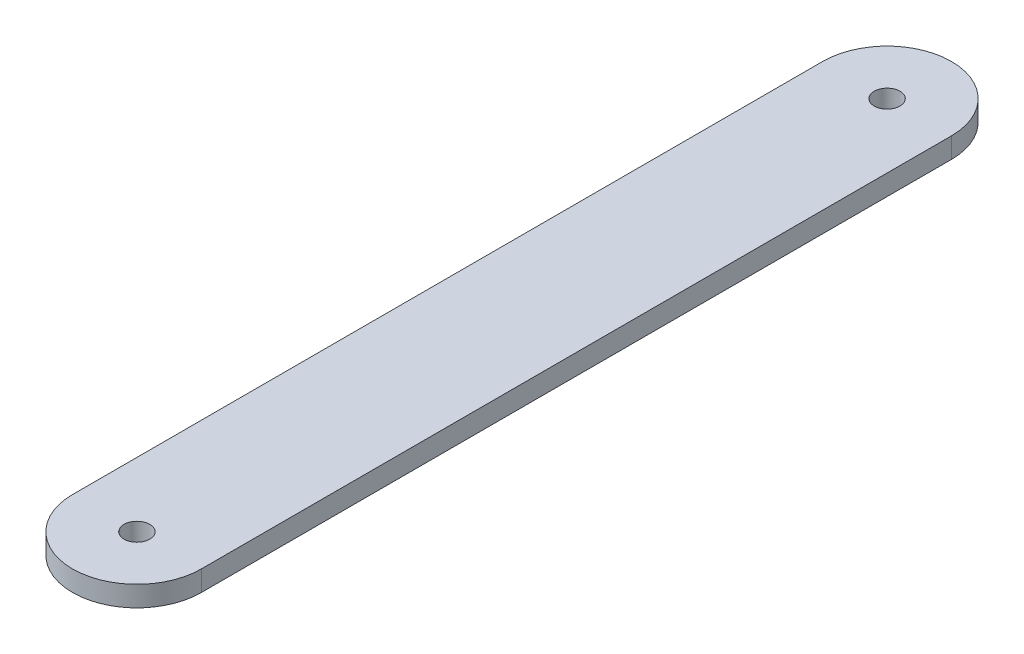
from build123d import *

# Parameters (mm, degrees)
SKETCH2_R           = 1
BOSS_EXTRUDE1_DEPTH = 1.5875


with BuildPart() as part:
    # Sketch2 → Boss-Extrude1 (new body)
    with BuildSketch(Plane(origin=(0, 0, 0), x_dir=(1, 0, 0), z_dir=(0, 1, 0))):
        with BuildLine():
            Line((-5, 58.2405), (-5, 0))
            ThreePointArc((-5, 0), (0, -5), (5, 0))
            Line((5, 0), (5, 58.2405))
            ThreePointArc((5, 58.2405), (0, 63.2405), (-5, 58.2405))
        make_face()
        with Locations(Location((0, 0, 0), (0, 0, 270))):
            Circle(SKETCH2_R, mode=Mode.SUBTRACT)
        with Locations(Location((0, 58.2405, 0), (0, 0, 270))):
            Circle(SKETCH2_R, mode=Mode.SUBTRACT)
    extrude(amount=BOSS_EXTRUDE1_DEPTH)


solid = part.part
